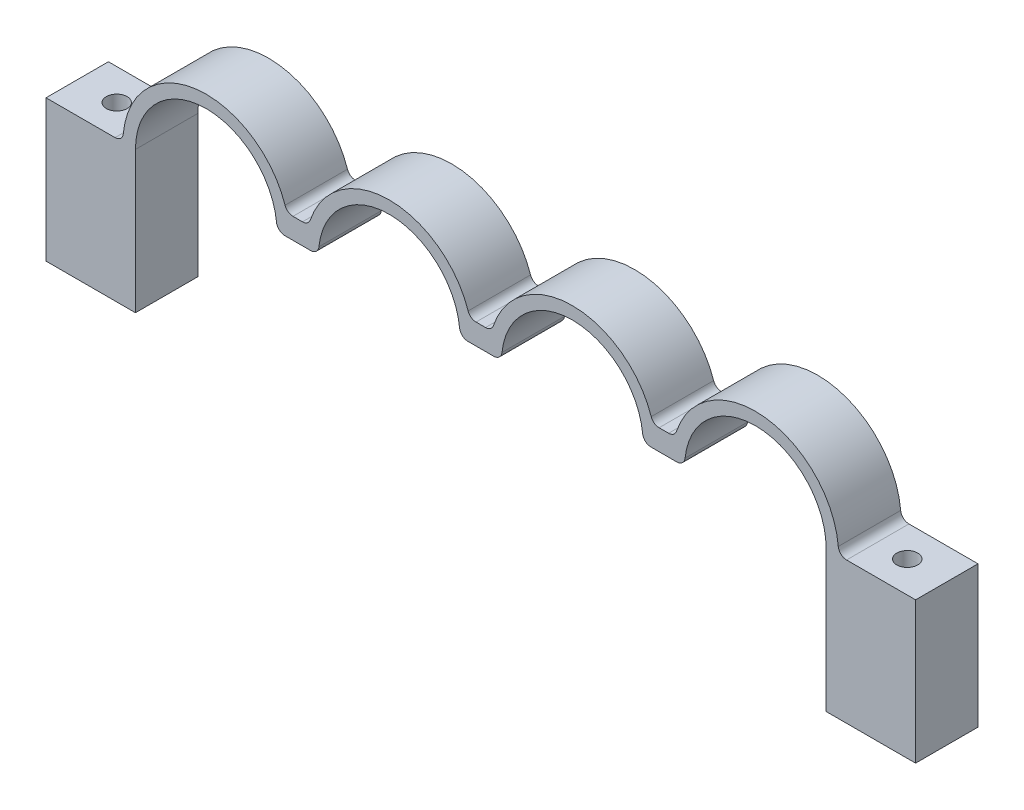
from build123d import *

# Parameters (mm, degrees)
EXTRUDE_1_DEPTH     = 15
EXTRUDE_2_DEPTH     = 15
EXTRUDE_2_2_DEPTH   = 15
EXTRUDE_2_3_DEPTH   = 15
SKETCH_3_W          = 7
SKETCH_3_H          = 15
EXTRUDE_3_DEPTH     = 5
SKETCH_4_W          = 40
SKETCH_4_H          = 15
EXTRUDE_4_DEPTH     = 34
SKETCH_6_R          = 2.5
CUT_EXTRUDE_2_DEPTH = 34
SKETCH_7_W          = 18.5
SKETCH_7_H          = 15
CUT_EXTRUDE_3_DEPTH = 100
FILLET_1_R          = 2
FILLET_2_R          = 2


with BuildPart() as part:
    # 草图1 → 凸台-拉伸1 (new body)
    with BuildSketch(Plane.XY):
        with BuildLine():
            Line((-20, 0), (-17, 0))
            ThreePointArc((-17, 0), (0, 17), (17, 0))
            Line((17, 0), (20, 0))
            ThreePointArc((20, 0), (0, 20), (-20, 0))
        make_face()
    extrude(amount=EXTRUDE_1_DEPTH)



with BuildPart() as body_2:
    # 草图2 → 凸台-拉伸2 (new body)
    with BuildSketch(Plane.XY.offset(15)):
        with BuildLine():
            Line((-152, 0), (-149, 0))
            ThreePointArc((-149, 0), (-132, 17), (-115, 0))
            Line((-115, 0), (-112, 0))
            ThreePointArc((-112, 0), (-132, 20), (-152, 0))
        make_face()
    extrude(amount=-EXTRUDE_2_DEPTH)


with BuildPart() as body_3:
    # 草图2 → Extrude 2 2 (new body)
    with BuildSketch(Plane.XY.offset(15)):
        with BuildLine():
            Line((-71, 0), (-68, 0))
            ThreePointArc((-68, 0), (-88, 20), (-108, 0))
            Line((-108, 0), (-105, 0))
            ThreePointArc((-105, 0), (-88, 17), (-71, 0))
        make_face()
    extrude(amount=-EXTRUDE_2_2_DEPTH)


with BuildPart() as body_4:
    # 草图2 → Extrude 2 3 (new body)
    with BuildSketch(Plane.XY.offset(15)):
        with BuildLine():
            Line((-27, 0), (-24, 0))
            ThreePointArc((-24, 0), (-44, 20), (-64, 0))
            Line((-64, 0), (-61, 0))
            ThreePointArc((-61, 0), (-44, 17), (-27, 0))
        make_face()
    extrude(amount=-EXTRUDE_2_3_DEPTH)


with BuildPart() as part_1:
    add(part.part)

    add(body_2.part)  # 凸台-拉伸3 merges body 2

    add(body_3.part)  # 凸台-拉伸3 merges body 3

    add(body_4.part)  # 凸台-拉伸3 merges body 4
    # 草图3 → 凸台-拉伸3 (add)
    with BuildSketch(Plane.XZ):
        with Locations((-110, 7.5)):
            Rectangle(SKETCH_3_W, SKETCH_3_H)
        with Locations((-66, 7.5)):
            Rectangle(SKETCH_3_W, SKETCH_3_H)
        with Locations((-22, 7.5)):
            Rectangle(SKETCH_3_W, SKETCH_3_H)
    extrude(amount=-EXTRUDE_3_DEPTH)

    # 草图4 → 凸台-拉伸4 (add)
    with BuildSketch(Plane.XZ):
        with Locations((37, 7.5)):
            Rectangle(SKETCH_4_W, SKETCH_4_H)
        with Locations((-169, 7.5)):
            Rectangle(SKETCH_4_W, SKETCH_4_H)
    extrude(amount=EXTRUDE_4_DEPTH)

    # 草图6 → 切除-拉伸2 (cut)
    with BuildSketch(Plane(origin=(0, 0, 0), x_dir=(1, 0, 0), z_dir=(0, 1, 0))):
        with Locations(Location((29, -7.5, 0), (0, 0, 270))):
            Circle(SKETCH_6_R)
        with Locations(Location((-161, -7.5, 0), (0, 0, 270))):
            Circle(SKETCH_6_R)
    extrude(amount=-CUT_EXTRUDE_2_DEPTH, mode=Mode.SUBTRACT)

    # 草图7 → 切除-拉伸3 (cut)
    with BuildSketch(Plane(origin=(0, 0, 0), x_dir=(1, 0, 0), z_dir=(0, 1, 0))):
        with Locations((-179.75, -7.5)):
            Rectangle(SKETCH_7_W, SKETCH_7_H)
        with Locations((47.75, -7.5)):
            Rectangle(SKETCH_7_W, SKETCH_7_H)
    extrude(amount=-CUT_EXTRUDE_3_DEPTH, mode=Mode.SUBTRACT)

    # 圆角1
    fillet_1_edges = [part_1.edges().sort_by_distance(p)[0] for p in [
        (-112.635083269, 5, 7.5),
        (-152, 0, 7.5),
        (-19.364916731, 5, 7.5),
        (-24.635083269, 5, 7.5),
        (-63.364916731, 5, 7.5),
        (-68.635083269, 5, 7.5),
        (20, 0, 7.5),
        (-107.364916731, 5, 7.5),
    ]]
    fillet(fillet_1_edges, radius=FILLET_1_R)

    # 圆角2
    fillet_2_edges = [part_1.edges().sort_by_distance(p)[0] for p in [
        (-115, 0, 7.5),
        (-27, 0, 7.5),
        (-61, 0, 7.5),
        (-71, 0, 7.5),
        (-105, 0, 7.5),
        (-17, 0, 7.5),
    ]]
    fillet(fillet_2_edges, radius=FILLET_2_R)


solid = part_1.part
